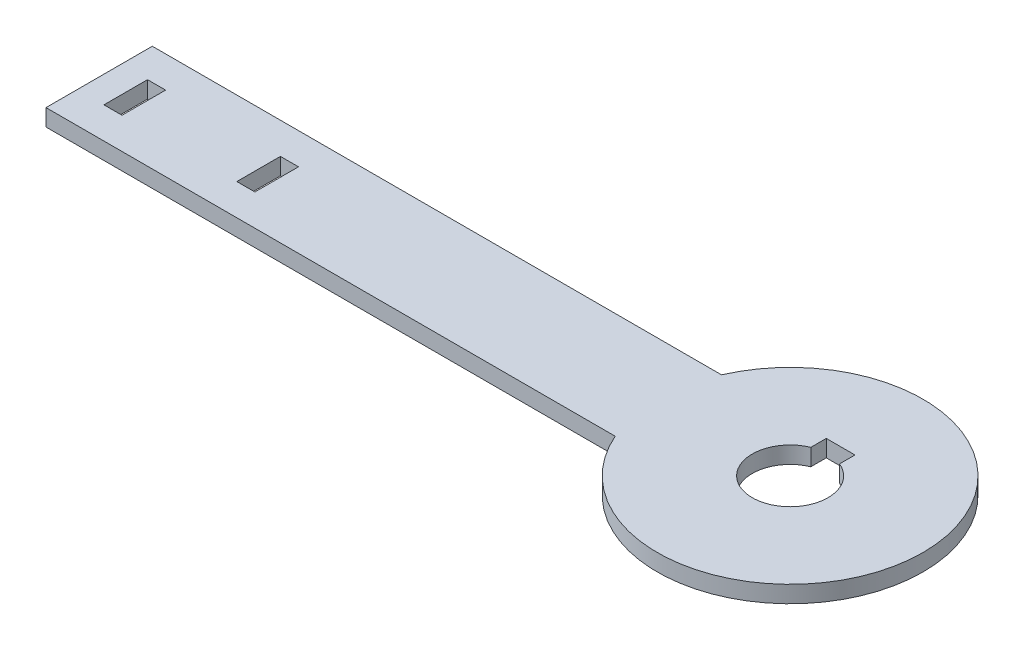
from build123d import *

# Parameters (mm, degrees)
SKETCH1_W           = 3.4
SKETCH1_H           = 8.2
BOSS_EXTRUDE1_DEPTH = 3.175


with BuildPart() as part:
    # Sketch1 → Boss-Extrude1 (new body)
    with BuildSketch(Plane(origin=(0, 0, 0), x_dir=(1, 0, 0), z_dir=(0, 1, 0))):
        with BuildLine():
            ThreePointArc((-22.912878475, -10), (25, 0), (-22.912878475, 10))
            Line((-22.912878475, 10), (-130, 10))
            Line((-130, 10), (-130, -10))
            Line((-130, -10), (-22.912878475, -10))
        make_face()
        with Locations((-123.3, 0)):
            Rectangle(SKETCH1_W, SKETCH1_H, mode=Mode.SUBTRACT)
        with Locations((-98.3, 0)):
            Rectangle(SKETCH1_W, SKETCH1_H, mode=Mode.SUBTRACT)
        with BuildLine():
            Line((-2.7, 6.593604856), (-2.7, 9.5))
            Line((-2.7, 9.5), (2.7, 9.5))
            Line((2.7, 9.5), (2.7, 6.593604856))
            ThreePointArc((2.7, 6.593604856), (0, -7.125), (-2.7, 6.593604856))
        make_face(mode=Mode.SUBTRACT)
    extrude(amount=BOSS_EXTRUDE1_DEPTH)


solid = part.part
